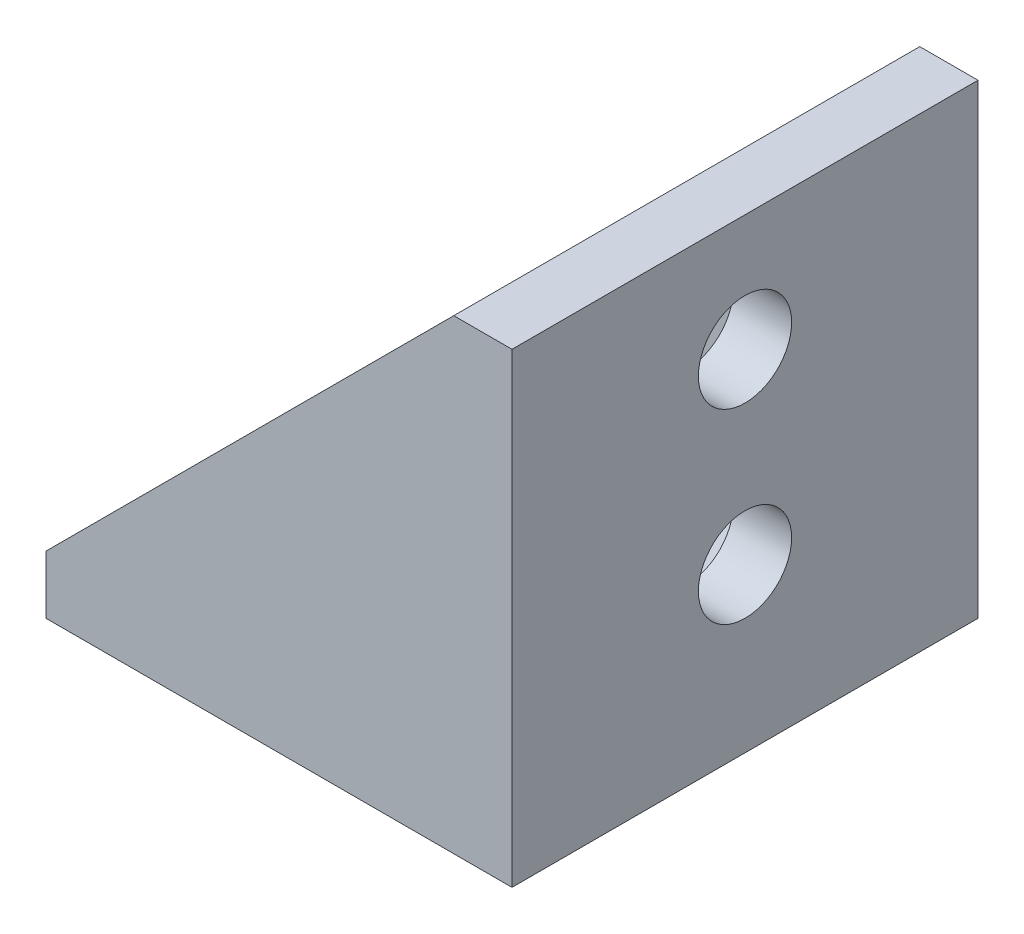
from build123d import *

# Parameters (mm, degrees)
EXTRUDE_1_DEPTH     = 20
CUT_EXTRUDE_START   = 20
SKETCH_2_W          = 17.5
SKETCH_2_H          = 16.6
CUT_EXTRUDE_1_DEPTH = 17.5
CUT_EXTRUDE_2_REACH = 36.641
SKETCH_3_R          = 2
CUT_EXTRUDE_3_REACH = 36.641
SKETCH_4_R          = 2


with BuildPart() as part:
    # 草图1 → 凸台-拉伸1 (new body)
    with BuildSketch(Plane.XY):
        Polygon((0, 0), (20, 0), (20, 20), (17.5, 20), (0, 2.5), align=None)
    extrude(amount=-EXTRUDE_1_DEPTH)

    # 草图2 → 切除-拉伸1 (cut)
    with BuildSketch(Plane(origin=(0, 0, 0), x_dir=(1, 0, 0), z_dir=(0, 1, 0)).offset(CUT_EXTRUDE_START)):
        with Locations((8.75, 10)):
            Rectangle(SKETCH_2_W, SKETCH_2_H)
    extrude(amount=-CUT_EXTRUDE_1_DEPTH, mode=Mode.SUBTRACT)

    # 草图3 → 切除-拉伸2 (cut, up to next)
    with BuildSketch(Plane(origin=(0, 0, 0), x_dir=(1, 0, 0), z_dir=(0, 1, 0)), mode=Mode.PRIVATE) as cut_extrude_2_sk1:
        with Locations(Location((5, 9.954039482, 0), (0, 0, 90))):
            Circle(SKETCH_3_R)
    cut_extrude_2_tool1 = extrude(cut_extrude_2_sk1.sketch, amount=CUT_EXTRUDE_2_REACH, mode=Mode.PRIVATE) & part.part
    # 草图3 → 切除-拉伸2 (cut, up to next)
    with BuildSketch(Plane(origin=(0, 0, 0), x_dir=(1, 0, 0), z_dir=(0, 1, 0)), mode=Mode.PRIVATE) as cut_extrude_2_sk2:
        with Locations(Location((13, 9.954039482, 0), (0, 0, 90))):
            Circle(SKETCH_3_R)
    cut_extrude_2_tool2 = extrude(cut_extrude_2_sk2.sketch, amount=CUT_EXTRUDE_2_REACH, mode=Mode.PRIVATE) & part.part
    add(cut_extrude_2_tool1.solids().sort_by_distance((5, 0, -9.954039))[0], mode=Mode.SUBTRACT)
    add(cut_extrude_2_tool2.solids().sort_by_distance((13, 0, -9.954039))[0], mode=Mode.SUBTRACT)

    # 草图4 → 切除-拉伸3 (cut, up to next)
    with BuildSketch(Plane(origin=(0, 0, 0), x_dir=(0, 0, -1), z_dir=(1, 0, 0)), mode=Mode.PRIVATE) as cut_extrude_3_sk1:
        with Locations(Location((10, 15, 0), (0, 0, 180))):
            Circle(SKETCH_4_R)
    cut_extrude_3_tool1 = extrude(cut_extrude_3_sk1.sketch, amount=CUT_EXTRUDE_3_REACH, mode=Mode.PRIVATE) & part.part
    # 草图4 → 切除-拉伸3 (cut, up to next)
    with BuildSketch(Plane(origin=(0, 0, 0), x_dir=(0, 0, -1), z_dir=(1, 0, 0)), mode=Mode.PRIVATE) as cut_extrude_3_sk2:
        with Locations(Location((10, 7, 0), (0, 0, 180))):
            Circle(SKETCH_4_R)
    cut_extrude_3_tool2 = extrude(cut_extrude_3_sk2.sketch, amount=CUT_EXTRUDE_3_REACH, mode=Mode.PRIVATE) & part.part
    add(cut_extrude_3_tool1.solids().sort_by_distance((0, 15, -10))[0], mode=Mode.SUBTRACT)
    add(cut_extrude_3_tool2.solids().sort_by_distance((0, 7, -10))[0], mode=Mode.SUBTRACT)


solid = part.part
